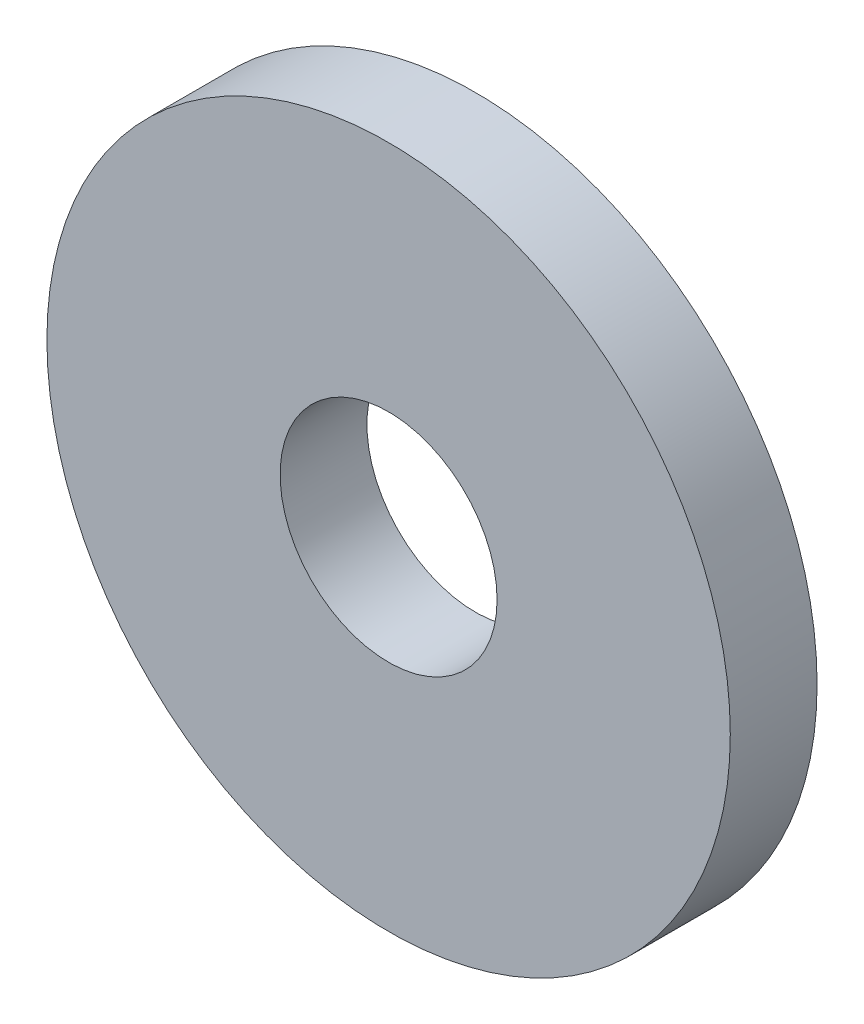
from build123d import *

# Parameters (mm, degrees)
SKETCH1_R           = 25
SKETCH1_R_2         = 7.9375
BOSS_EXTRUDE1_DEPTH = 6.35


with BuildPart() as part:
    # Sketch1 → Boss-Extrude1 (new body)
    with BuildSketch(Plane.XY):
        Circle(SKETCH1_R)
        Circle(SKETCH1_R_2, mode=Mode.SUBTRACT)
    extrude(amount=BOSS_EXTRUDE1_DEPTH)


solid = part.part
